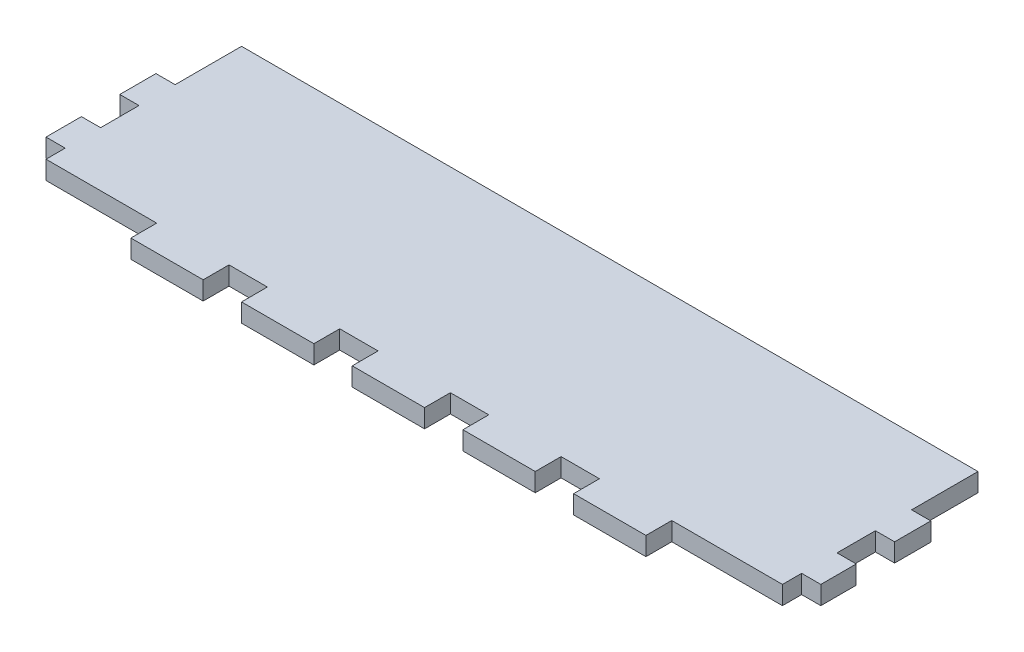
from build123d import *

# Parameters (mm, degrees)
SKETCH1_W           = 266.7
SKETCH1_H           = 57.15
BOSS_EXTRUDE1_DEPTH = 6.35
SKETCH3_W           = 24.892
SKETCH3_H           = 8.89
BOSS_EXTRUDE2_DEPTH = 6.35
SKETCH4_W           = 13.208
SKETCH4_H           = 13.208
CUT_EXTRUDE2_DEPTH  = 139.65846972
SKETCH5_W           = 295.464136086
SKETCH5_H           = 12.7
CUT_EXTRUDE3_DEPTH  = 139.65846972
SKETCH6_W           = 266.7
SKETCH6_H           = 12.446
BOSS_EXTRUDE3_DEPTH = 6.35
SKETCH7_W           = 253.492
SKETCH7_H           = 22.86
BOSS_EXTRUDE4_DEPTH = 6.35


with BuildPart() as part:
    # Sketch1 → Boss-Extrude1 (new body)
    with BuildSketch(Plane(origin=(0, 0, 0), x_dir=(1, 0, 0), z_dir=(0, 1, 0))):
        Rectangle(SKETCH1_W, SKETCH1_H)
    extrude(amount=BOSS_EXTRUDE1_DEPTH)

    # Sketch3 → Boss-Extrude2 (add)
    with BuildSketch(Plane(origin=(0, 0, 0), x_dir=(1, 0, 0), z_dir=(0, 1, 0))):
        with Locations((-76.2, -33.02)):
            Rectangle(SKETCH3_W, SKETCH3_H)
        with Locations((-38.1, -33.02)):
            Rectangle(SKETCH3_W, SKETCH3_H)
        with Locations((0, -33.02)):
            Rectangle(SKETCH3_W, SKETCH3_H)
        with Locations((38.1, -33.02)):
            Rectangle(SKETCH3_W, SKETCH3_H)
        with Locations((76.2, -33.02)):
            Rectangle(SKETCH3_W, SKETCH3_H)
    extrude(amount=BOSS_EXTRUDE2_DEPTH)

    # Sketch4 → Cut-Extrude2 (cut, through all)
    with BuildSketch(Plane(origin=(0, 0, 0), x_dir=(1, 0, 0), z_dir=(0, 1, 0))):
        with Locations((-133.35, 22.225)):
            Rectangle(SKETCH4_W, SKETCH4_H)
        with Locations((133.35, 22.225)):
            Rectangle(SKETCH4_W, SKETCH4_H)
        with Locations((-133.35, -3.175)):
            Rectangle(SKETCH4_W, SKETCH4_H)
        with Locations((-133.35, -28.575)):
            Rectangle(SKETCH4_W, SKETCH4_H)
        with Locations((133.35, -3.175)):
            Rectangle(SKETCH4_W, SKETCH4_H)
        with Locations((133.35, -28.575)):
            Rectangle(SKETCH4_W, SKETCH4_H)
    extrude(amount=CUT_EXTRUDE2_DEPTH, mode=Mode.SUBTRACT)

    # Sketch5 → Cut-Extrude3 (cut, through all)
    with BuildSketch(Plane(origin=(0, 6.35, 0), x_dir=(1, 0, 0), z_dir=(0, 1, 0))):
        with Locations((7.963252738, 22.225)):
            Rectangle(SKETCH5_W, SKETCH5_H)
    extrude(amount=-CUT_EXTRUDE3_DEPTH, mode=Mode.SUBTRACT)

    # Sketch6 → Boss-Extrude3 (add)
    with BuildSketch(Plane(origin=(0, 6.35, 0), x_dir=(1, 0, 0), z_dir=(0, 1, 0))):
        with Locations((0, 9.652)):
            Rectangle(SKETCH6_W, SKETCH6_H)
    extrude(amount=-BOSS_EXTRUDE3_DEPTH)

    # Sketch7 → Boss-Extrude4 (add)
    with BuildSketch(Plane(origin=(0, 6.35, 0), x_dir=(1, 0, 0), z_dir=(0, 1, 0))):
        with Locations((0, 27.305)):
            Rectangle(SKETCH7_W, SKETCH7_H)
    extrude(amount=-BOSS_EXTRUDE4_DEPTH)


solid = part.part
